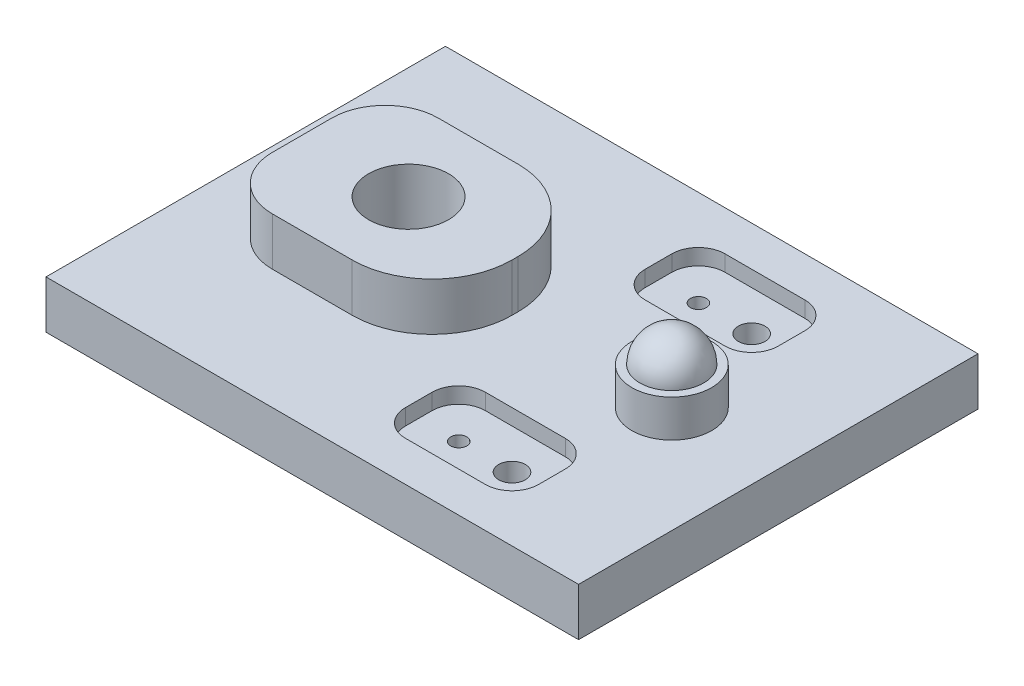
from build123d import *

# Parameters (mm, degrees)
SKETCH1_W           = 100
SKETCH1_H           = 75
BOSS_EXTRUDE1_DEPTH = 9
SKETCH2_W           = 40
SKETCH2_H           = 31.155322697
BOSS_EXTRUDE2_DEPTH = 9
FILLET1_R           = 10
FILLET2_R           = 15
SKETCH3_R           = 7.5
CUT_EXTRUDE1_DEPTH  = 127.289350303
SKETCH4_W           = 25
SKETCH4_H           = 15
CUT_EXTRUDE2_DEPTH  = 3
FILLET3_R           = 5
SKETCH5_R           = 1.5
SKETCH5_R_2         = 2.5
CUT_EXTRUDE3_DEPTH  = 7
SKETCH6_R           = 7.5
BOSS_EXTRUDE3_DEPTH = 7


with BuildPart() as part:
    # Sketch1 → Boss-Extrude1 (new body)
    with BuildSketch(Plane(origin=(0, 0, 0), x_dir=(1, 0, 0), z_dir=(0, 1, 0))):
        with Locations((50, -37.5)):
            Rectangle(SKETCH1_W, SKETCH1_H)
    extrude(amount=BOSS_EXTRUDE1_DEPTH)

    # Sketch2 → Boss-Extrude2 (add)
    with BuildSketch(Plane(origin=(0, 9, 0), x_dir=(1, 0, 0), z_dir=(0, 1, 0))):
        with Locations((30, -36.922338651)):
            Rectangle(SKETCH2_W, SKETCH2_H)
    extrude(amount=BOSS_EXTRUDE2_DEPTH)

    # Fillet1
    fillet1_edges = [part.edges().sort_by_distance(p)[0] for p in [
        (10, 13.5, 21.344677303),
        (10, 13.5, 52.5),
    ]]
    fillet(fillet1_edges, radius=FILLET1_R)

    # Fillet2
    fillet2_edges = [part.edges().sort_by_distance(p)[0] for p in [
        (50, 13.5, 52.5),
        (50, 13.5, 21.344677303),
    ]]
    fillet(fillet2_edges, radius=FILLET2_R)

    # Sketch3 → Cut-Extrude1 (cut, through all)
    with BuildSketch(Plane(origin=(0, 18, 0), x_dir=(1, 0, 0), z_dir=(0, 1, 0))):
        with Locations(Location((30, -36.922338651, 0), (0, 0, 270))):
            Circle(SKETCH3_R)
    extrude(amount=-CUT_EXTRUDE1_DEPTH, mode=Mode.SUBTRACT)

    # Sketch4 → Cut-Extrude2 (cut)
    with BuildSketch(Plane(origin=(0, 9, 0), x_dir=(1, 0, 0), z_dir=(0, 1, 0))):
        with Locations((67.5, -60)):
            Rectangle(SKETCH4_W, SKETCH4_H)
        with Locations((67.5, -15)):
            Rectangle(SKETCH4_W, SKETCH4_H)
    extrude(amount=-CUT_EXTRUDE2_DEPTH, mode=Mode.SUBTRACT)

    # Fillet3
    fillet3_edges = [part.edges().sort_by_distance(p)[0] for p in [
        (55, 7.5, 67.5),
        (55, 7.5, 52.5),
        (80, 7.5, 52.5),
        (80, 7.5, 67.5),
        (80, 7.5, 22.5),
        (55, 7.5, 22.5),
        (55, 7.5, 7.5),
        (80, 7.5, 7.5),
    ]]
    fillet(fillet3_edges, radius=FILLET3_R)

    # Sketch5 → Cut-Extrude3 (cut)
    with BuildSketch(Plane(origin=(0, 6, 0), x_dir=(1, 0, 0), z_dir=(0, 1, 0))):
        with Locations(Location((62.5, -60, 0), (0, 0, 270))):
            Circle(SKETCH5_R)
        with Locations(Location((72.5, -60, 0), (0, 0, 270))):
            Circle(SKETCH5_R_2)
        with Locations(Location((72.5, -15, 0), (0, 0, 270))):
            Circle(SKETCH5_R_2)
        with Locations(Location((62.5, -15, 0), (0, 0, 270))):
            Circle(SKETCH5_R)
    extrude(amount=-CUT_EXTRUDE3_DEPTH, mode=Mode.SUBTRACT)

    # Sketch6 → Boss-Extrude3 (add)
    with BuildSketch(Plane(origin=(0, 9, 0), x_dir=(1, 0, 0), z_dir=(0, 1, 0))):
        with Locations(Location((80, -37.5, 0), (0, 0, 270))):
            Circle(SKETCH6_R)
    extrude(amount=BOSS_EXTRUDE3_DEPTH)

    # Sketch7 → Revolve1 (revolve)
    with BuildSketch(Plane(origin=(0, 16, 0), x_dir=(1, 0, 0), z_dir=(0, 1, 0))):
        with BuildLine():
            Line((74, -37.5), (86, -37.5))
            ThreePointArc((86, -37.5), (80, -43.5), (74, -37.5))
        make_face()
    revolve(axis=Axis((72.5, 16, 37.5), (1, 0, 0)))


solid = part.part
